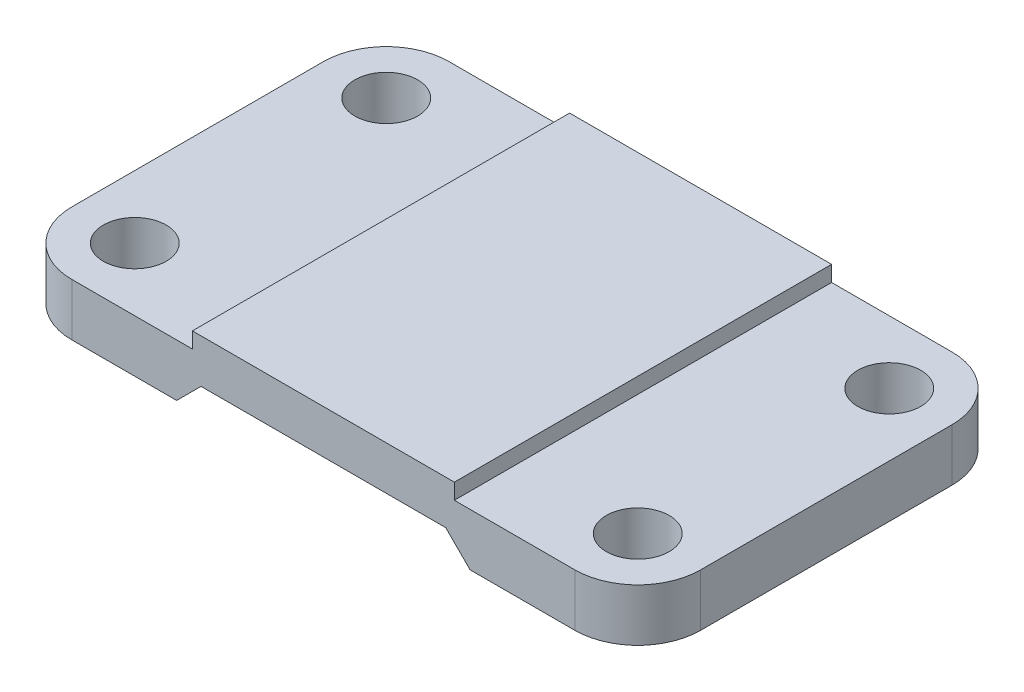
from build123d import *

# Parameters (mm, degrees)
BOSS_EXTRUDE1_DEPTH = 72
SKETCH3_R           = 6
CUT_EXTRUDE1_DEPTH  = 72


with BuildPart() as part:
    # Sketch1 → Boss-Extrude1 (new body)
    with BuildSketch(Plane.XY):
        Polygon((0, 0), (0, 10), (35, 10), (35, 13), (85, 13), (85, 10), (120, 10), (120, 0), (88, 0), (83.349169446, 4.650830554), (36.650830554, 4.650830554), (32, 0), align=None)
    extrude(amount=BOSS_EXTRUDE1_DEPTH)

    # Sketch3 → Cut-Extrude1 (cut)
    with BuildSketch(Plane(origin=(0, 10, 0), x_dir=(1, 0, 0), z_dir=(0, 1, 0))):
        with Locations(Location((12, -12, 0), (0, 0, 270))):
            Circle(SKETCH3_R)
        with Locations(Location((108, -12, 0), (0, 0, 270))):
            Circle(SKETCH3_R)
        with Locations(Location((108, -60, 0), (0, 0, 270))):
            Circle(SKETCH3_R)
        with Locations(Location((12, -60, 0), (0, 0, 270))):
            Circle(SKETCH3_R)
        with BuildLine():
            ThreePointArc((0, -12), (3.514718626, -3.514718626), (12, 0))
            Line((12, 0), (0, 0))
            Line((0, 0), (0, -12))
        make_face()
        with BuildLine():
            ThreePointArc((12, -72), (3.514718626, -68.485281374), (0, -60))
            Line((0, -60), (0, -72))
            Line((0, -72), (12, -72))
        make_face()
        with BuildLine():
            Line((120, -72), (120, -60))
            ThreePointArc((120, -60), (116.485281374, -68.485281374), (108, -72))
            Line((108, -72), (120, -72))
        make_face()
        with BuildLine():
            Line((120, 0), (108, 0))
            ThreePointArc((108, 0), (116.485281374, -3.514718626), (120, -12))
            Line((120, -12), (120, 0))
        make_face()
    extrude(amount=-CUT_EXTRUDE1_DEPTH, mode=Mode.SUBTRACT)


solid = part.part
